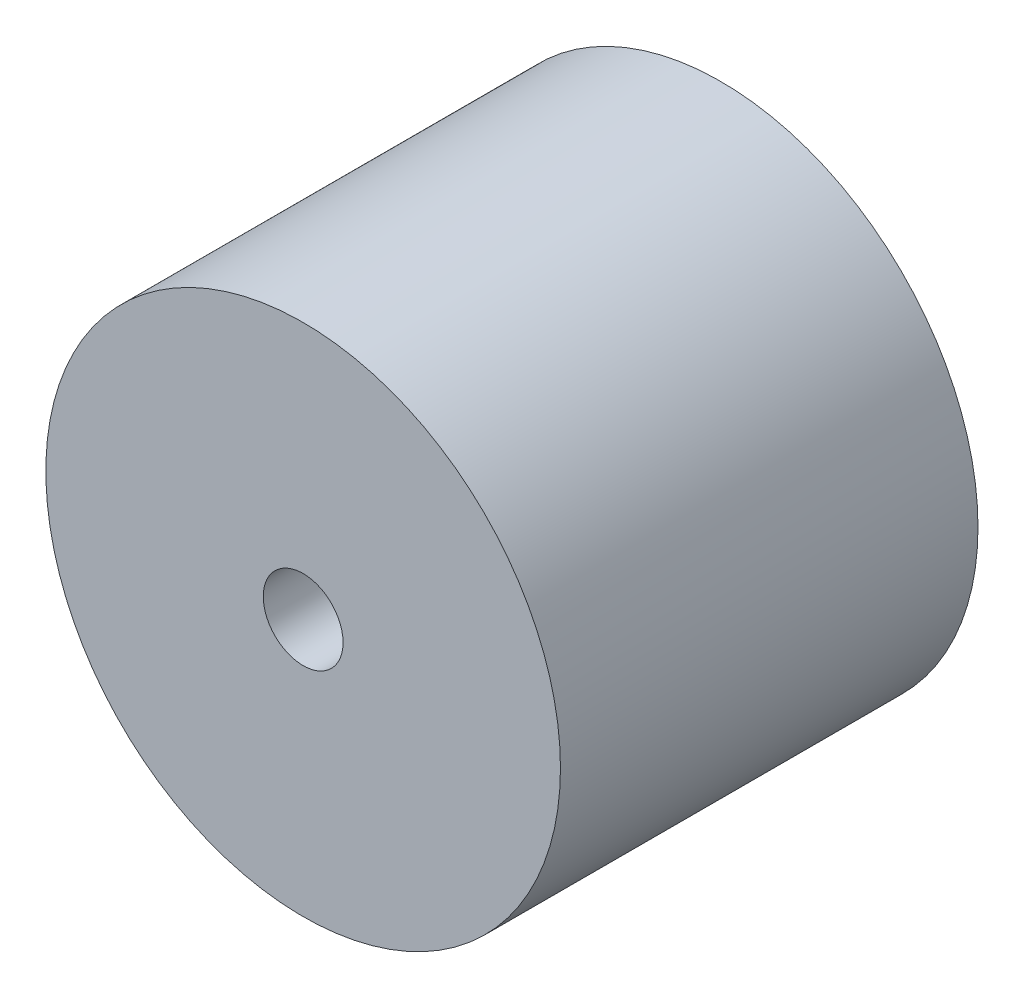
from build123d import *

# Parameters (mm, degrees)
SKETCH2_R           = 26.5
SKETCH2_R_2         = 4.11
BOSS_EXTRUDE1_DEPTH = 43


with BuildPart() as part:
    # Sketch2 → Boss-Extrude1 (new body)
    with BuildSketch(Plane.XY):
        Circle(SKETCH2_R)
        Circle(SKETCH2_R_2, mode=Mode.SUBTRACT)
    extrude(amount=BOSS_EXTRUDE1_DEPTH)


solid = part.part
